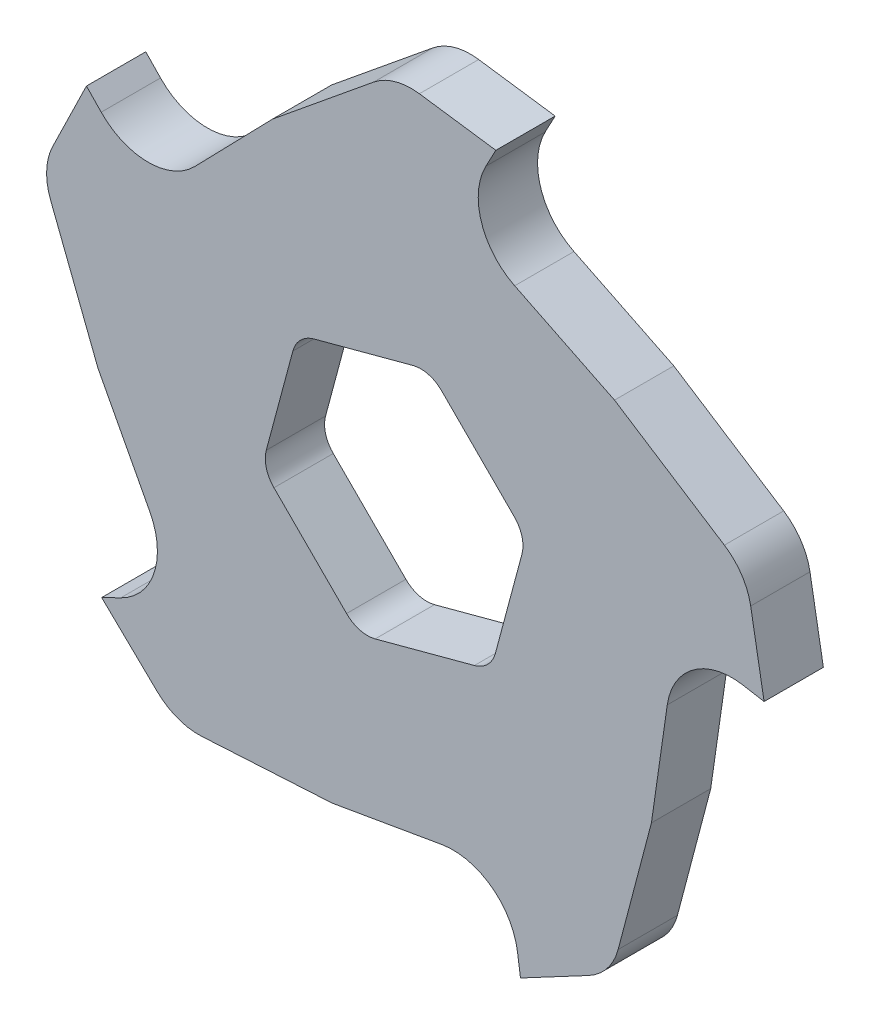
from build123d import *

# Parameters (mm, degrees)
BOSS_EXTRUDE1_DEPTH = 20
FILLET1_R           = 10


with BuildPart() as part:
    # Sketch2 → Boss-Extrude1 (new body)
    with BuildSketch(Plane.XY):
        with BuildLine():
            Line((8.524308176, 123.574202785), (34.312591702, 119.949895893))
            Line((34.312591702, 119.949895893), (30.946870999, 113.619895893))
            ThreePointArc((30.946870999, 113.619895893), (29.437456237, 96.527152904), (40.66334756, 83.549496728))
            Line((40.66334756, 83.549496728), (74.333931823, 66.991594994))
            Line((74.333931823, 66.991594994), (111.389403677, 43.150824518))
            ThreePointArc((111.389403677, 43.150824518), (117.222239734, 37.405423132), (120.264178278, 29.804224315))
            Line((120.264178278, 29.804224315), (124.786275456, 4.158136801))
            Line((124.786275456, 4.158136801), (117.726022813, 5.403049832))
            ThreePointArc((117.726022813, 5.403049832), (101.003423398, 1.556640514), (92.129930121, -13.130132886))
            Line((92.129930121, -13.130132886), (86.787212529, -50.269434484))
            Line((86.787212529, -50.269434484), (75.564062952, -92.878485691))
            ThreePointArc((75.564062952, -92.878485691), (71.902306992, -100.201269099), (65.613148031, -105.443224185))
            Line((65.613148031, -105.443224185), (42.619674262, -117.669071055))
            Line((42.619674262, -117.669071055), (41.621918861, -110.569672489))
            ThreePointArc((41.621918861, -110.569672489), (32.796198806, -95.854141193), (16.086187039, -91.953410163))
            Line((16.086187039, -91.953410163), (-20.886378289, -98.348859135))
            Line((-20.886378289, -98.348859135), (-64.878138042, -100.841930533))
            ThreePointArc((-64.878138042, -100.841930533), (-72.974063741, -99.622258186), (-79.902916283, -95.26076578))
            Line((-79.902916283, -95.26076578), (-98.635761771, -77.170667172))
            Line((-98.635761771, -77.170667172), (-92.192155877, -74.02791059))
            ThreePointArc((-92.192155877, -74.02791059), (-80.924151432, -61.086802768), (-82.37801338, -43.989245011))
            Line((-82.37801338, -43.989245011), (-99.885597812, -10.802548251))
            Line((-99.885597812, -10.802548251), (-115.850850987, 30.265700095))
            ThreePointArc((-115.850850987, 30.265700095), (-117.19265228, 38.342282469), (-115.185759692, 46.279788104))
            Line((-115.185759692, 46.279788104), (-103.76982114, 69.685930773))
            Line((-103.76982114, 69.685930773), (-98.789698287, 64.528862593))
            ThreePointArc((-98.789698287, 64.528862593), (-82.999968499, 57.811375783), (-67.188492831, 64.477516571))
            Line((-67.188492831, 64.477516571), (-41.036209743, 91.383472116))
            Line((-41.036209743, 91.383472116), (-6.911519091, 119.25811685))
            ThreePointArc((-6.911519091, 119.25811685), (0.355127803, 123.030046924), (8.524308176, 123.574202785))
        make_face()
        Polygon((-11.954339629, -44.614202866), (32.659863237, -32.659863237), (44.614202866, 11.954339629), (11.954339629, 44.614202866), (-32.659863237, 32.659863237), (-44.614202866, -11.954339629), align=None, mode=Mode.SUBTRACT)
    extrude(amount=BOSS_EXTRUDE1_DEPTH)

    # Fillet1
    fillet1_edges = [part.edges().sort_by_distance(p)[0] for p in [
        (-44.614202866, -11.954339629, 10),
        (-11.954339629, -44.614202866, 10),
        (32.659863237, -32.659863237, 10),
        (44.614202866, 11.954339629, 10),
        (11.954339629, 44.614202866, 10),
        (-32.659863237, 32.659863237, 10),
    ]]
    fillet(fillet1_edges, radius=FILLET1_R)


solid = part.part
